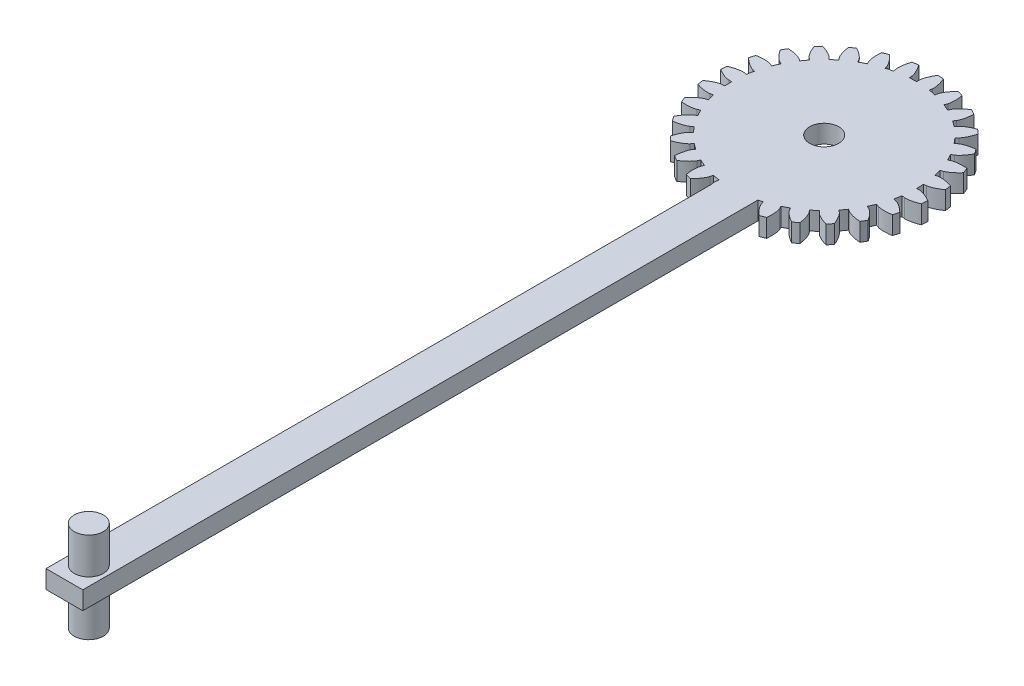
from build123d import *

# Parameters (mm, degrees)
EXTRUDE_1_DEPTH      = 5
EXTRUDE_2_DEPTH      = 5
SKETCH_4_W           = 10.147504873
SKETCH_4_H           = 5
EXTRUDE_3_DEPTH      = 180
SKETCH_5_R           = 4
CUT_EXTRUDE_1_DEPTH  = 5
EXTRUDE_4_DEPTH      = 10
EXTRUDE_4_DEPTH_BACK = 15
SKETCH_6_R           = 4


with BuildPart() as part:
    # 草图2 → 凸台-拉伸1 (new body)
    with BuildSketch(Plane(origin=(0, 0, 0), x_dir=(1, 0, 0), z_dir=(0, 1, 0))):
        with BuildLine():
            ThreePointArc((5.674283816, 24.860661761), (4.721957639, 25.058992718), (3.762759949, 25.220857193))
            Line((3.762759949, 25.220857193), (3.882488518, 26.023368433))
            add(Edge.make_bspline(
                [(3.882488518, 26.023368433), (3.885169692, 26.044536124), (3.891229626, 26.104071682), (3.896943735, 26.217198026), (3.89805291, 26.402160209), (3.882559672, 26.746092522), (3.8224221, 27.265903373), (3.710566644, 27.833686628), (3.551908723, 28.428019082), (3.361840182, 29.019737609), (3.221786448, 29.39905368), (3.111462526, 29.673387537), (3.03867645, 29.845710671)],
                knots=[0, 0, 0, 0, 0, 0.005376748, 0.015083688, 0.02853182, 0.046610139, 0.092110525, 0.146842495, 0.174208853, 0.201574955, 0.248725847, 0.248725847, 0.248725847, 0.248725847, 0.248725847], degree=4))
            ThreePointArc((3.03867645, 29.845710671), (2.219470551, 29.917786524), (1.398596861, 29.967381047))
            add(Edge.make_bspline(
                [(0, 26.311393382), (0.000471664, 26.332724987), (0.003263086, 26.392503021), (0.014304363, 26.505234166), (0.040500204, 26.688335279), (0.106574223, 27.026216471), (0.242756363, 27.531463216), (0.437169013, 28.076525771), (0.681789371, 28.640940763), (0.957090794, 29.198135514), (1.151582972, 29.552633078), (1.301179692, 29.807684553), (1.398596861, 29.967381047)],
                knots=[0, 0, 0, 0, 0, 0.005376748, 0.015083688, 0.02853182, 0.046610139, 0.092110525, 0.146842495, 0.174208853, 0.201574955, 0.248725847, 0.248725847, 0.248725847, 0.248725847, 0.248725847], degree=4))
            Line((0, 26.311393382), (0, 25.5))
            ThreePointArc((0, 25.5), (-0.972582162, 25.481445876), (-1.943748997, 25.425810505))
            Line((-1.943748997, 25.425810505), (-2.005597824, 26.234843226))
            add(Edge.make_bspline(
                [(-2.005597824, 26.234843226), (-2.007694127, 26.256076816), (-2.015034035, 26.315468155), (-2.034636171, 26.427029694), (-2.074712763, 26.607601304), (-2.166349692, 26.939462946), (-2.340648286, 27.432859185), (-2.576042953, 27.961516748), (-2.862974401, 28.505643338), (-3.179947286, 29.040232016), (-3.400895347, 29.378872954), (-3.569498244, 29.621779306), (-3.678804926, 29.773585513)],
                knots=[0, 0, 0, 0, 0, 0.005376748, 0.015083688, 0.02853182, 0.046610139, 0.092110525, 0.146842495, 0.174208853, 0.201574955, 0.248725847, 0.248725847, 0.248725847, 0.248725847, 0.248725847], degree=4))
            ThreePointArc((-3.678804926, 29.773585513), (-4.493510008, 29.661563812), (-5.304838501, 29.527253317))
            add(Edge.make_bspline(
                [(-5.854835829, 25.651711817), (-5.859122719, 25.672613549), (-5.869703148, 25.731513973), (-5.884023739, 25.843875627), (-5.899228513, 26.028215136), (-5.909996746, 26.372327794), (-5.889656954, 26.895210325), (-5.821406464, 27.469867909), (-5.7085134, 28.074564988), (-5.564101855, 28.679050034), (-5.45336913, 29.067938185), (-5.364277406, 29.349883388), (-5.304838501, 29.527253317)],
                knots=[0, 0, 0, 0, 0, 0.005376748, 0.015083688, 0.02853182, 0.046610139, 0.092110525, 0.146842495, 0.174208853, 0.201574955, 0.248725847, 0.248725847, 0.248725847, 0.248725847, 0.248725847], degree=4))
            Line((-5.854835829, 25.651711817), (-5.674283816, 24.860661761))
            ThreePointArc((-5.674283816, 24.860661761), (-6.618352631, 24.626152936), (-7.552790252, 24.355807509))
            Line((-7.552790252, 24.355807509), (-7.793115116, 25.130793432))
            add(Edge.make_bspline(
                [(-7.793115116, 25.130793432), (-7.799883778, 25.15102818), (-7.820255476, 25.207297171), (-7.864190923, 25.311699744), (-7.943443675, 25.478826166), (-8.106629238, 25.781976208), (-8.386348794, 26.224216888), (-8.733478999, 26.687239661), (-9.134296034, 27.153875607), (-9.562278919, 27.604527929), (-9.853042048, 27.885512862), (-10.071469467, 28.084811371), (-10.211815661, 28.208488455)],
                knots=[0, 0, 0, 0, 0, 0.005376748, 0.015083688, 0.02853182, 0.046610139, 0.092110525, 0.146842495, 0.174208853, 0.201574955, 0.248725847, 0.248725847, 0.248725847, 0.248725847, 0.248725847], degree=4))
            ThreePointArc((-10.211815661, 28.208488455), (-10.981167213, 27.917986436), (-11.74226711, 27.606505811))
            add(Edge.make_bspline(
                [(-11.416085742, 23.705746308), (-11.424916224, 23.725170068), (-11.448337956, 23.780239368), (-11.48730232, 23.88659725), (-11.543145279, 24.062931602), (-11.6302158, 24.39602048), (-11.726738278, 24.910319284), (-11.788072312, 25.485756165), (-11.812567472, 26.100413296), (-11.806287203, 26.721877232), (-11.784866534, 27.125655494), (-11.760747234, 27.420356516), (-11.74226711, 27.606505811)],
                knots=[0, 0, 0, 0, 0, 0.005376748, 0.015083688, 0.02853182, 0.046610139, 0.092110525, 0.146842495, 0.174208853, 0.201574955, 0.248725847, 0.248725847, 0.248725847, 0.248725847, 0.248725847], degree=4))
            Line((-11.416085742, 23.705746308), (-11.064035347, 22.974706132))
            ThreePointArc((-11.064035347, 22.974706132), (-11.932251264, 22.536001859), (-12.783103065, 22.064502623))
            Line((-12.783103065, 22.064502623), (-13.189853074, 22.766580718))
            add(Edge.make_bspline(
                [(-13.189853074, 22.766580718), (-13.200954688, 22.784801969), (-13.233336653, 22.83512705), (-13.299402305, 22.927135476), (-13.413857152, 23.072436294), (-13.640408543, 23.331673528), (-14.011522755, 23.700582853), (-14.452981941, 24.074752941), (-14.947585923, 24.440499168), (-15.465117958, 24.784617545), (-15.811116079, 24.993856716), (-16.068415157, 25.139553722), (-16.232763319, 25.228899996)],
                knots=[0, 0, 0, 0, 0, 0.005376748, 0.015083688, 0.02853182, 0.046610139, 0.092110525, 0.146842495, 0.174208853, 0.201574955, 0.248725847, 0.248725847, 0.248725847, 0.248725847, 0.248725847], degree=4))
            ThreePointArc((-16.232763319, 25.228899996), (-16.91818284, 24.774484644), (-17.590889414, 24.301452829))
            add(Edge.make_bspline(
                [(-16.404885446, 20.571075694), (-16.417816723, 20.588047492), (-16.452905295, 20.636524264), (-16.514559597, 20.731545145), (-16.60824054, 20.8910322), (-16.76724727, 21.19639483), (-16.975791979, 21.676320818), (-17.163634993, 22.223682188), (-17.324290086, 22.817477896), (-17.456456012, 23.424757924), (-17.52542152, 23.82317917), (-17.567484088, 24.115858471), (-17.590889414, 24.301452829)],
                knots=[0, 0, 0, 0, 0, 0.005376748, 0.015083688, 0.02853182, 0.046610139, 0.092110525, 0.146842495, 0.174208853, 0.201574955, 0.248725847, 0.248725847, 0.248725847, 0.248725847, 0.248725847], degree=4))
            Line((-16.404885446, 20.571075694), (-15.898989947, 19.936702803))
            ThreePointArc((-15.898989947, 19.936702803), (-16.647816994, 19.315801545), (-17.372417714, 18.666791443))
            Line((-17.372417714, 18.666791443), (-17.925196724, 19.260756582))
            add(Edge.make_bspline(
                [(-17.925196724, 19.260756582), (-17.940074607, 19.276050647), (-17.982843073, 19.317908308), (-18.067726121, 19.3929089), (-18.21164382, 19.509098123), (-18.490200806, 19.711423312), (-18.934100457, 19.988502629), (-19.447752018, 20.255057581), (-20.011341437, 20.501574047), (-20.592471407, 20.721902945), (-20.976354728, 20.848904229), (-21.259623414, 20.933693875), (-21.439732441, 20.984229146)],
                knots=[0, 0, 0, 0, 0, 0.005376748, 0.015083688, 0.02853182, 0.046610139, 0.092110525, 0.146842495, 0.174208853, 0.201574955, 0.248725847, 0.248725847, 0.248725847, 0.248725847, 0.248725847], degree=4))
            ThreePointArc((-21.439732441, 20.984229146), (-22.006850136, 20.388686743), (-22.55743107, 19.777823528))
            add(Edge.make_bspline(
                [(-20.571075694, 16.404885446), (-20.587459336, 16.418554246), (-20.632455262, 16.458007663), (-20.713707897, 16.536926799), (-20.840529271, 16.671569209), (-21.063498948, 16.933893435), (-21.373608584, 17.355381113), (-21.678541345, 17.847219988), (-21.967300456, 18.390378876), (-22.231285225, 18.953023441), (-22.387178691, 19.326109165), (-22.493313935, 19.602090583), (-22.55743107, 19.777823528)],
                knots=[0, 0, 0, 0, 0, 0.005376748, 0.015083688, 0.02853182, 0.046610139, 0.092110525, 0.146842495, 0.174208853, 0.201574955, 0.248725847, 0.248725847, 0.248725847, 0.248725847, 0.248725847], degree=4))
            Line((-20.571075694, 16.404885446), (-19.936702803, 15.898989947))
            ThreePointArc((-19.936702803, 15.898989947), (-20.528591664, 15.127026287), (-21.090606797, 14.333049394))
            Line((-21.090606797, 14.333049394), (-21.761696161, 14.789117685))
            add(Edge.make_bspline(
                [(-21.761696161, 14.789117685), (-21.779604274, 14.800717656), (-21.830614651, 14.832008979), (-21.930058706, 14.886240894), (-22.096222622, 14.96749231), (-22.412817192, 15.102760023), (-22.907243301, 15.274115418), (-23.467330601, 15.419689056), (-24.071644732, 15.534614396), (-24.687232352, 15.620105605), (-25.089751361, 15.658500626), (-25.384785381, 15.678131206), (-25.571623855, 15.687321423)],
                knots=[0, 0, 0, 0, 0, 0.005376748, 0.015083688, 0.02853182, 0.046610139, 0.092110525, 0.146842495, 0.174208853, 0.201574955, 0.248725847, 0.248725847, 0.248725847, 0.248725847, 0.248725847], degree=4))
            ThreePointArc((-25.571623855, 15.687321423), (-25.992002073, 14.980514953), (-26.39284894, 14.262451571))
            add(Edge.make_bspline(
                [(-23.705746308, 11.416085742), (-23.724760773, 11.425766133), (-23.777407768, 11.454217835), (-23.874184389, 11.513077892), (-24.027786842, 11.616124125), (-24.303538835, 11.822255913), (-24.699663207, 12.164170129), (-25.106395113, 12.575823654), (-25.508778653, 13.041109468), (-25.891344967, 13.530905222), (-26.126349242, 13.859947348), (-26.291235096, 14.105392022), (-26.39284894, 14.262451571)],
                knots=[0, 0, 0, 0, 0, 0.005376748, 0.015083688, 0.02853182, 0.046610139, 0.092110525, 0.146842495, 0.174208853, 0.201574955, 0.248725847, 0.248725847, 0.248725847, 0.248725847, 0.248725847], degree=4))
            Line((-23.705746308, 11.416085742), (-22.974706132, 11.064035347))
            ThreePointArc((-22.974706132, 11.064035347), (-23.379977028, 10.179718766), (-23.751224789, 9.280588399))
            Line((-23.751224789, 9.280588399), (-24.506973283, 9.575890673))
            add(Edge.make_bspline(
                [(-24.506973283, 9.575890673), (-24.527013639, 9.583214879), (-24.583708053, 9.602370786), (-24.692726575, 9.63311461), (-24.872804556, 9.675353934), (-25.211561337, 9.736781283), (-25.731721314, 9.793820281), (-26.310159238, 9.811112935), (-26.924895245, 9.788684312), (-27.544072382, 9.735050946), (-27.945043095, 9.682914418), (-28.237048212, 9.636401573), (-28.42124727, 9.6037859)],
                knots=[0, 0, 0, 0, 0, 0.005376748, 0.015083688, 0.02853182, 0.046610139, 0.092110525, 0.146842495, 0.174208853, 0.201574955, 0.248725847, 0.248725847, 0.248725847, 0.248725847, 0.248725847], degree=4))
            ThreePointArc((-28.42124727, 9.6037859), (-28.673806493, 8.82115759), (-28.904819158, 8.031900736))
            add(Edge.make_bspline(
                [(-25.651711817, 5.854835829), (-25.672403638, 5.860042396), (-25.730061763, 5.876065696), (-25.837509587, 5.911915184), (-26.01019085, 5.978198071), (-26.324897803, 6.117801115), (-26.78717358, 6.362996862), (-27.275309395, 6.67382301), (-27.771140173, 7.037904376), (-28.253104559, 7.430290914), (-28.555435548, 7.698789896), (-28.770803948, 7.901390206), (-28.904819158, 8.031900736)],
                knots=[0, 0, 0, 0, 0, 0.005376748, 0.015083688, 0.02853182, 0.046610139, 0.092110525, 0.146842495, 0.174208853, 0.201574955, 0.248725847, 0.248725847, 0.248725847, 0.248725847, 0.248725847], degree=4))
            Line((-25.651711817, 5.854835829), (-24.860661761, 5.674283816))
            ThreePointArc((-24.860661761, 5.674283816), (-25.058992718, 4.721957639), (-25.220857193, 3.762759949))
            Line((-25.220857193, 3.762759949), (-26.023368433, 3.882488518))
            add(Edge.make_bspline(
                [(-26.023368433, 3.882488518), (-26.044536124, 3.885169692), (-26.104071682, 3.891229626), (-26.217198026, 3.896943735), (-26.402160209, 3.89805291), (-26.746092522, 3.882559672), (-27.265903373, 3.8224221), (-27.833686628, 3.710566644), (-28.428019082, 3.551908723), (-29.019737609, 3.361840182), (-29.39905368, 3.221786448), (-29.673387537, 3.111462526), (-29.845710671, 3.03867645)],
                knots=[0, 0, 0, 0, 0, 0.005376748, 0.015083688, 0.02853182, 0.046610139, 0.092110525, 0.146842495, 0.174208853, 0.201574955, 0.248725847, 0.248725847, 0.248725847, 0.248725847, 0.248725847], degree=4))
            ThreePointArc((-29.845710671, 3.03867645), (-29.917786524, 2.219470551), (-29.967381047, 1.398596861))
            add(Edge.make_bspline(
                [(-26.311393382, 0), (-26.332724987, 0.000471664), (-26.392503021, 0.003263086), (-26.505234166, 0.014304363), (-26.688335279, 0.040500204), (-27.026216471, 0.106574223), (-27.531463216, 0.242756363), (-28.076525771, 0.437169013), (-28.640940763, 0.681789371), (-29.198135514, 0.957090794), (-29.552633078, 1.151582972), (-29.807684553, 1.301179692), (-29.967381047, 1.398596861)],
                knots=[0, 0, 0, 0, 0, 0.005376748, 0.015083688, 0.02853182, 0.046610139, 0.092110525, 0.146842495, 0.174208853, 0.201574955, 0.248725847, 0.248725847, 0.248725847, 0.248725847, 0.248725847], degree=4))
            Line((-26.311393382, 0), (-25.5, 0))
            ThreePointArc((-25.5, 0), (-25.481445876, -0.972582162), (-25.425810505, -1.943748997))
            Line((-25.425810505, -1.943748997), (-26.234843226, -2.005597824))
            add(Edge.make_bspline(
                [(-26.234843226, -2.005597824), (-26.256076816, -2.007694127), (-26.315468155, -2.015034035), (-26.427029694, -2.034636171), (-26.607601304, -2.074712763), (-26.939462946, -2.166349692), (-27.432859185, -2.340648286), (-27.961516748, -2.576042953), (-28.505643338, -2.862974401), (-29.040232016, -3.179947286), (-29.378872954, -3.400895347), (-29.621779306, -3.569498244), (-29.773585513, -3.678804926)],
                knots=[0, 0, 0, 0, 0, 0.005376748, 0.015083688, 0.02853182, 0.046610139, 0.092110525, 0.146842495, 0.174208853, 0.201574955, 0.248725847, 0.248725847, 0.248725847, 0.248725847, 0.248725847], degree=4))
            ThreePointArc((-29.773585513, -3.678804926), (-29.661563812, -4.493510008), (-29.527253317, -5.304838501))
            add(Edge.make_bspline(
                [(-25.651711817, -5.854835829), (-25.672613549, -5.859122719), (-25.731513973, -5.869703148), (-25.843875627, -5.884023739), (-26.028215136, -5.899228513), (-26.372327794, -5.909996746), (-26.895210325, -5.889656954), (-27.469867909, -5.821406464), (-28.074564988, -5.7085134), (-28.679050034, -5.564101855), (-29.067938185, -5.45336913), (-29.349883388, -5.364277406), (-29.527253317, -5.304838501)],
                knots=[0, 0, 0, 0, 0, 0.005376748, 0.015083688, 0.02853182, 0.046610139, 0.092110525, 0.146842495, 0.174208853, 0.201574955, 0.248725847, 0.248725847, 0.248725847, 0.248725847, 0.248725847], degree=4))
            Line((-25.651711817, -5.854835829), (-24.860661761, -5.674283816))
            ThreePointArc((-24.860661761, -5.674283816), (-24.626152936, -6.618352631), (-24.355807509, -7.552790252))
            Line((-24.355807509, -7.552790252), (-25.130793432, -7.793115116))
            add(Edge.make_bspline(
                [(-25.130793432, -7.793115116), (-25.15102818, -7.799883778), (-25.207297171, -7.820255476), (-25.311699744, -7.864190923), (-25.478826166, -7.943443675), (-25.781976208, -8.106629238), (-26.224216888, -8.386348794), (-26.687239661, -8.733478999), (-27.153875607, -9.134296034), (-27.604527929, -9.562278919), (-27.885512862, -9.853042048), (-28.084811371, -10.071469467), (-28.208488455, -10.211815661)],
                knots=[0, 0, 0, 0, 0, 0.005376748, 0.015083688, 0.02853182, 0.046610139, 0.092110525, 0.146842495, 0.174208853, 0.201574955, 0.248725847, 0.248725847, 0.248725847, 0.248725847, 0.248725847], degree=4))
            ThreePointArc((-28.208488455, -10.211815661), (-27.917986436, -10.981167213), (-27.606505811, -11.74226711))
            add(Edge.make_bspline(
                [(-23.705746308, -11.416085742), (-23.725170068, -11.424916224), (-23.780239368, -11.448337956), (-23.88659725, -11.48730232), (-24.062931602, -11.543145279), (-24.39602048, -11.6302158), (-24.910319284, -11.726738278), (-25.485756165, -11.788072312), (-26.100413296, -11.812567472), (-26.721877232, -11.806287203), (-27.125655494, -11.784866534), (-27.420356516, -11.760747234), (-27.606505811, -11.74226711)],
                knots=[0, 0, 0, 0, 0, 0.005376748, 0.015083688, 0.02853182, 0.046610139, 0.092110525, 0.146842495, 0.174208853, 0.201574955, 0.248725847, 0.248725847, 0.248725847, 0.248725847, 0.248725847], degree=4))
            Line((-23.705746308, -11.416085742), (-22.974706132, -11.064035347))
            ThreePointArc((-22.974706132, -11.064035347), (-22.536001859, -11.932251264), (-22.064502623, -12.783103065))
            Line((-22.064502623, -12.783103065), (-22.766580718, -13.189853074))
            add(Edge.make_bspline(
                [(-22.766580718, -13.189853074), (-22.784801969, -13.200954688), (-22.83512705, -13.233336653), (-22.927135476, -13.299402305), (-23.072436294, -13.413857152), (-23.331673528, -13.640408543), (-23.700582853, -14.011522755), (-24.074752941, -14.452981941), (-24.440499168, -14.947585923), (-24.784617545, -15.465117958), (-24.993856716, -15.811116079), (-25.139553722, -16.068415157), (-25.228899996, -16.232763319)],
                knots=[0, 0, 0, 0, 0, 0.005376748, 0.015083688, 0.02853182, 0.046610139, 0.092110525, 0.146842495, 0.174208853, 0.201574955, 0.248725847, 0.248725847, 0.248725847, 0.248725847, 0.248725847], degree=4))
            ThreePointArc((-25.228899996, -16.232763319), (-24.774484644, -16.91818284), (-24.301452829, -17.590889414))
            add(Edge.make_bspline(
                [(-20.571075694, -16.404885446), (-20.588047492, -16.417816723), (-20.636524264, -16.452905295), (-20.731545145, -16.514559597), (-20.8910322, -16.60824054), (-21.19639483, -16.76724727), (-21.676320818, -16.975791979), (-22.223682188, -17.163634993), (-22.817477896, -17.324290086), (-23.424757924, -17.456456012), (-23.82317917, -17.52542152), (-24.115858471, -17.567484088), (-24.301452829, -17.590889414)],
                knots=[0, 0, 0, 0, 0, 0.005376748, 0.015083688, 0.02853182, 0.046610139, 0.092110525, 0.146842495, 0.174208853, 0.201574955, 0.248725847, 0.248725847, 0.248725847, 0.248725847, 0.248725847], degree=4))
            Line((-20.571075694, -16.404885446), (-19.936702803, -15.898989947))
            ThreePointArc((-19.936702803, -15.898989947), (-19.315801545, -16.647816994), (-18.666791443, -17.372417714))
            Line((-18.666791443, -17.372417714), (-19.260756582, -17.925196724))
            add(Edge.make_bspline(
                [(-19.260756582, -17.925196724), (-19.276050647, -17.940074607), (-19.317908308, -17.982843073), (-19.3929089, -18.067726121), (-19.509098123, -18.21164382), (-19.711423312, -18.490200806), (-19.988502629, -18.934100457), (-20.255057581, -19.447752018), (-20.501574047, -20.011341437), (-20.721902945, -20.592471407), (-20.848904229, -20.976354728), (-20.933693875, -21.259623414), (-20.984229146, -21.439732441)],
                knots=[0, 0, 0, 0, 0, 0.005376748, 0.015083688, 0.02853182, 0.046610139, 0.092110525, 0.146842495, 0.174208853, 0.201574955, 0.248725847, 0.248725847, 0.248725847, 0.248725847, 0.248725847], degree=4))
            ThreePointArc((-20.984229146, -21.439732441), (-20.388686743, -22.006850136), (-19.777823528, -22.55743107))
            add(Edge.make_bspline(
                [(-16.404885446, -20.571075694), (-16.418554246, -20.587459336), (-16.458007663, -20.632455262), (-16.536926799, -20.713707897), (-16.671569209, -20.840529271), (-16.933893435, -21.063498948), (-17.355381113, -21.373608584), (-17.847219988, -21.678541345), (-18.390378876, -21.967300456), (-18.953023441, -22.231285225), (-19.326109165, -22.387178691), (-19.602090583, -22.493313935), (-19.777823528, -22.55743107)],
                knots=[0, 0, 0, 0, 0, 0.005376748, 0.015083688, 0.02853182, 0.046610139, 0.092110525, 0.146842495, 0.174208853, 0.201574955, 0.248725847, 0.248725847, 0.248725847, 0.248725847, 0.248725847], degree=4))
            Line((-16.404885446, -20.571075694), (-15.898989947, -19.936702803))
            ThreePointArc((-15.898989947, -19.936702803), (-15.127026287, -20.528591664), (-14.333049394, -21.090606797))
            Line((-14.333049394, -21.090606797), (-14.789117685, -21.761696161))
            add(Edge.make_bspline(
                [(-14.789117685, -21.761696161), (-14.800717656, -21.779604274), (-14.832008979, -21.830614651), (-14.886240894, -21.930058706), (-14.96749231, -22.096222622), (-15.102760023, -22.412817192), (-15.274115418, -22.907243301), (-15.419689056, -23.467330601), (-15.534614396, -24.071644732), (-15.620105605, -24.687232352), (-15.658500626, -25.089751361), (-15.678131206, -25.384785381), (-15.687321423, -25.571623855)],
                knots=[0, 0, 0, 0, 0, 0.005376748, 0.015083688, 0.02853182, 0.046610139, 0.092110525, 0.146842495, 0.174208853, 0.201574955, 0.248725847, 0.248725847, 0.248725847, 0.248725847, 0.248725847], degree=4))
            ThreePointArc((-15.687321423, -25.571623855), (-14.980514953, -25.992002073), (-14.262451571, -26.39284894))
            add(Edge.make_bspline(
                [(-11.416085742, -23.705746308), (-11.425766133, -23.724760773), (-11.454217835, -23.777407768), (-11.513077892, -23.874184389), (-11.616124125, -24.027786842), (-11.822255913, -24.303538835), (-12.164170129, -24.699663207), (-12.575823654, -25.106395113), (-13.041109468, -25.508778653), (-13.530905222, -25.891344967), (-13.859947348, -26.126349242), (-14.105392022, -26.291235096), (-14.262451571, -26.39284894)],
                knots=[0, 0, 0, 0, 0, 0.005376748, 0.015083688, 0.02853182, 0.046610139, 0.092110525, 0.146842495, 0.174208853, 0.201574955, 0.248725847, 0.248725847, 0.248725847, 0.248725847, 0.248725847], degree=4))
            Line((-11.416085742, -23.705746308), (-11.064035347, -22.974706132))
            ThreePointArc((-11.064035347, -22.974706132), (-10.179718766, -23.379977028), (-9.280588399, -23.751224789))
            Line((-9.280588399, -23.751224789), (-9.575890673, -24.506973283))
            add(Edge.make_bspline(
                [(-9.575890673, -24.506973283), (-9.583214879, -24.527013639), (-9.602370786, -24.583708053), (-9.63311461, -24.692726575), (-9.675353934, -24.872804556), (-9.736781283, -25.211561337), (-9.793820281, -25.731721314), (-9.811112935, -26.310159238), (-9.788684312, -26.924895245), (-9.735050946, -27.544072382), (-9.682914418, -27.945043095), (-9.636401573, -28.237048212), (-9.6037859, -28.42124727)],
                knots=[0, 0, 0, 0, 0, 0.005376748, 0.015083688, 0.02853182, 0.046610139, 0.092110525, 0.146842495, 0.174208853, 0.201574955, 0.248725847, 0.248725847, 0.248725847, 0.248725847, 0.248725847], degree=4))
            ThreePointArc((-9.6037859, -28.42124727), (-8.82115759, -28.673806493), (-8.031900736, -28.904819158))
            add(Edge.make_bspline(
                [(-5.854835829, -25.651711817), (-5.860042396, -25.672403638), (-5.876065696, -25.730061763), (-5.911915184, -25.837509587), (-5.978198071, -26.01019085), (-6.117801115, -26.324897803), (-6.362996862, -26.78717358), (-6.67382301, -27.275309395), (-7.037904376, -27.771140173), (-7.430290914, -28.253104559), (-7.698789896, -28.555435548), (-7.901390206, -28.770803948), (-8.031900736, -28.904819158)],
                knots=[0, 0, 0, 0, 0, 0.005376748, 0.015083688, 0.02853182, 0.046610139, 0.092110525, 0.146842495, 0.174208853, 0.201574955, 0.248725847, 0.248725847, 0.248725847, 0.248725847, 0.248725847], degree=4))
            Line((-5.854835829, -25.651711817), (-5.674283816, -24.860661761))
            ThreePointArc((-5.674283816, -24.860661761), (-4.721957639, -25.058992718), (-3.762759949, -25.220857193))
            Line((-3.762759949, -25.220857193), (-3.882488518, -26.023368433))
            add(Edge.make_bspline(
                [(-3.882488518, -26.023368433), (-3.885169692, -26.044536124), (-3.891229626, -26.104071682), (-3.896943735, -26.217198026), (-3.89805291, -26.402160209), (-3.882559672, -26.746092522), (-3.8224221, -27.265903373), (-3.710566644, -27.833686628), (-3.551908723, -28.428019082), (-3.361840182, -29.019737609), (-3.221786448, -29.39905368), (-3.111462526, -29.673387537), (-3.03867645, -29.845710671)],
                knots=[0, 0, 0, 0, 0, 0.005376748, 0.015083688, 0.02853182, 0.046610139, 0.092110525, 0.146842495, 0.174208853, 0.201574955, 0.248725847, 0.248725847, 0.248725847, 0.248725847, 0.248725847], degree=4))
            ThreePointArc((-3.03867645, -29.845710671), (-2.219470551, -29.917786524), (-1.398596861, -29.967381047))
            add(Edge.make_bspline(
                [(0, -26.311393382), (-0.000471664, -26.332724987), (-0.003263086, -26.392503021), (-0.014304363, -26.505234166), (-0.040500204, -26.688335279), (-0.106574223, -27.026216471), (-0.242756363, -27.531463216), (-0.437169013, -28.076525771), (-0.681789371, -28.640940763), (-0.957090794, -29.198135514), (-1.151582972, -29.552633078), (-1.301179692, -29.807684553), (-1.398596861, -29.967381047)],
                knots=[0, 0, 0, 0, 0, 0.005376748, 0.015083688, 0.02853182, 0.046610139, 0.092110525, 0.146842495, 0.174208853, 0.201574955, 0.248725847, 0.248725847, 0.248725847, 0.248725847, 0.248725847], degree=4))
            Line((0, -26.311393382), (0, -25.5))
            ThreePointArc((0, -25.5), (0.972582162, -25.481445876), (1.943748997, -25.425810505))
            Line((1.943748997, -25.425810505), (2.005597824, -26.234843226))
            add(Edge.make_bspline(
                [(2.005597824, -26.234843226), (2.007694127, -26.256076816), (2.015034035, -26.315468155), (2.034636171, -26.427029694), (2.074712763, -26.607601304), (2.166349692, -26.939462946), (2.340648286, -27.432859185), (2.576042953, -27.961516748), (2.862974401, -28.505643338), (3.179947286, -29.040232016), (3.400895347, -29.378872954), (3.569498244, -29.621779306), (3.678804926, -29.773585513)],
                knots=[0, 0, 0, 0, 0, 0.005376748, 0.015083688, 0.02853182, 0.046610139, 0.092110525, 0.146842495, 0.174208853, 0.201574955, 0.248725847, 0.248725847, 0.248725847, 0.248725847, 0.248725847], degree=4))
            ThreePointArc((3.678804926, -29.773585513), (4.493510008, -29.661563812), (5.304838501, -29.527253317))
            add(Edge.make_bspline(
                [(5.854835829, -25.651711817), (5.859122719, -25.672613549), (5.869703148, -25.731513973), (5.884023739, -25.843875627), (5.899228513, -26.028215136), (5.909996746, -26.372327794), (5.889656954, -26.895210325), (5.821406464, -27.469867909), (5.7085134, -28.074564988), (5.564101855, -28.679050034), (5.45336913, -29.067938185), (5.364277406, -29.349883388), (5.304838501, -29.527253317)],
                knots=[0, 0, 0, 0, 0, 0.005376748, 0.015083688, 0.02853182, 0.046610139, 0.092110525, 0.146842495, 0.174208853, 0.201574955, 0.248725847, 0.248725847, 0.248725847, 0.248725847, 0.248725847], degree=4))
            Line((5.854835829, -25.651711817), (5.674283816, -24.860661761))
            ThreePointArc((5.674283816, -24.860661761), (6.618352631, -24.626152936), (7.552790252, -24.355807509))
            Line((7.552790252, -24.355807509), (7.793115116, -25.130793432))
            add(Edge.make_bspline(
                [(7.793115116, -25.130793432), (7.799883778, -25.15102818), (7.820255476, -25.207297171), (7.864190923, -25.311699744), (7.943443675, -25.478826166), (8.106629238, -25.781976208), (8.386348794, -26.224216888), (8.733478999, -26.687239661), (9.134296034, -27.153875607), (9.562278919, -27.604527929), (9.853042048, -27.885512862), (10.071469467, -28.084811371), (10.211815661, -28.208488455)],
                knots=[0, 0, 0, 0, 0, 0.005376748, 0.015083688, 0.02853182, 0.046610139, 0.092110525, 0.146842495, 0.174208853, 0.201574955, 0.248725847, 0.248725847, 0.248725847, 0.248725847, 0.248725847], degree=4))
            ThreePointArc((10.211815661, -28.208488455), (10.981167213, -27.917986436), (11.74226711, -27.606505811))
            add(Edge.make_bspline(
                [(11.416085742, -23.705746308), (11.424916224, -23.725170068), (11.448337956, -23.780239368), (11.48730232, -23.88659725), (11.543145279, -24.062931602), (11.6302158, -24.39602048), (11.726738278, -24.910319284), (11.788072312, -25.485756165), (11.812567472, -26.100413296), (11.806287203, -26.721877232), (11.784866534, -27.125655494), (11.760747234, -27.420356516), (11.74226711, -27.606505811)],
                knots=[0, 0, 0, 0, 0, 0.005376748, 0.015083688, 0.02853182, 0.046610139, 0.092110525, 0.146842495, 0.174208853, 0.201574955, 0.248725847, 0.248725847, 0.248725847, 0.248725847, 0.248725847], degree=4))
            Line((11.416085742, -23.705746308), (11.064035347, -22.974706132))
            ThreePointArc((11.064035347, -22.974706132), (11.932251264, -22.536001859), (12.783103065, -22.064502623))
            Line((12.783103065, -22.064502623), (13.189853074, -22.766580718))
            add(Edge.make_bspline(
                [(13.189853074, -22.766580718), (13.200954688, -22.784801969), (13.233336653, -22.83512705), (13.299402305, -22.927135476), (13.413857152, -23.072436294), (13.640408543, -23.331673528), (14.011522755, -23.700582853), (14.452981941, -24.074752941), (14.947585923, -24.440499168), (15.465117958, -24.784617545), (15.811116079, -24.993856716), (16.068415157, -25.139553722), (16.232763319, -25.228899996)],
                knots=[0, 0, 0, 0, 0, 0.005376748, 0.015083688, 0.02853182, 0.046610139, 0.092110525, 0.146842495, 0.174208853, 0.201574955, 0.248725847, 0.248725847, 0.248725847, 0.248725847, 0.248725847], degree=4))
            ThreePointArc((16.232763319, -25.228899996), (16.91818284, -24.774484644), (17.590889414, -24.301452829))
            add(Edge.make_bspline(
                [(16.404885446, -20.571075694), (16.417816723, -20.588047492), (16.452905295, -20.636524264), (16.514559597, -20.731545145), (16.60824054, -20.8910322), (16.76724727, -21.19639483), (16.975791979, -21.676320818), (17.163634993, -22.223682188), (17.324290086, -22.817477896), (17.456456012, -23.424757924), (17.52542152, -23.82317917), (17.567484088, -24.115858471), (17.590889414, -24.301452829)],
                knots=[0, 0, 0, 0, 0, 0.005376748, 0.015083688, 0.02853182, 0.046610139, 0.092110525, 0.146842495, 0.174208853, 0.201574955, 0.248725847, 0.248725847, 0.248725847, 0.248725847, 0.248725847], degree=4))
            Line((16.404885446, -20.571075694), (15.898989947, -19.936702803))
            ThreePointArc((15.898989947, -19.936702803), (16.647816994, -19.315801545), (17.372417714, -18.666791443))
            Line((17.372417714, -18.666791443), (17.925196724, -19.260756582))
            add(Edge.make_bspline(
                [(17.925196724, -19.260756582), (17.940074607, -19.276050647), (17.982843073, -19.317908308), (18.067726121, -19.3929089), (18.21164382, -19.509098123), (18.490200806, -19.711423312), (18.934100457, -19.988502629), (19.447752018, -20.255057581), (20.011341437, -20.501574047), (20.592471407, -20.721902945), (20.976354728, -20.848904229), (21.259623414, -20.933693875), (21.439732441, -20.984229146)],
                knots=[0, 0, 0, 0, 0, 0.005376748, 0.015083688, 0.02853182, 0.046610139, 0.092110525, 0.146842495, 0.174208853, 0.201574955, 0.248725847, 0.248725847, 0.248725847, 0.248725847, 0.248725847], degree=4))
            ThreePointArc((21.439732441, -20.984229146), (22.006850136, -20.388686743), (22.55743107, -19.777823528))
            add(Edge.make_bspline(
                [(20.571075694, -16.404885446), (20.587459336, -16.418554246), (20.632455262, -16.458007663), (20.713707897, -16.536926799), (20.840529271, -16.671569209), (21.063498948, -16.933893435), (21.373608584, -17.355381113), (21.678541345, -17.847219988), (21.967300456, -18.390378876), (22.231285225, -18.953023441), (22.387178691, -19.326109165), (22.493313935, -19.602090583), (22.55743107, -19.777823528)],
                knots=[0, 0, 0, 0, 0, 0.005376748, 0.015083688, 0.02853182, 0.046610139, 0.092110525, 0.146842495, 0.174208853, 0.201574955, 0.248725847, 0.248725847, 0.248725847, 0.248725847, 0.248725847], degree=4))
            Line((20.571075694, -16.404885446), (19.936702803, -15.898989947))
            ThreePointArc((19.936702803, -15.898989947), (20.528591664, -15.127026287), (21.090606797, -14.333049394))
            Line((21.090606797, -14.333049394), (21.761696161, -14.789117685))
            add(Edge.make_bspline(
                [(21.761696161, -14.789117685), (21.779604274, -14.800717656), (21.830614651, -14.832008979), (21.930058706, -14.886240894), (22.096222622, -14.96749231), (22.412817192, -15.102760023), (22.907243301, -15.274115418), (23.467330601, -15.419689056), (24.071644732, -15.534614396), (24.687232352, -15.620105605), (25.089751361, -15.658500626), (25.384785381, -15.678131206), (25.571623855, -15.687321423)],
                knots=[0, 0, 0, 0, 0, 0.005376748, 0.015083688, 0.02853182, 0.046610139, 0.092110525, 0.146842495, 0.174208853, 0.201574955, 0.248725847, 0.248725847, 0.248725847, 0.248725847, 0.248725847], degree=4))
            ThreePointArc((25.571623855, -15.687321423), (25.992002073, -14.980514953), (26.39284894, -14.262451571))
            add(Edge.make_bspline(
                [(23.705746308, -11.416085742), (23.724760773, -11.425766133), (23.777407768, -11.454217835), (23.874184389, -11.513077892), (24.027786842, -11.616124125), (24.303538835, -11.822255913), (24.699663207, -12.164170129), (25.106395113, -12.575823654), (25.508778653, -13.041109468), (25.891344967, -13.530905222), (26.126349242, -13.859947348), (26.291235096, -14.105392022), (26.39284894, -14.262451571)],
                knots=[0, 0, 0, 0, 0, 0.005376748, 0.015083688, 0.02853182, 0.046610139, 0.092110525, 0.146842495, 0.174208853, 0.201574955, 0.248725847, 0.248725847, 0.248725847, 0.248725847, 0.248725847], degree=4))
            Line((23.705746308, -11.416085742), (22.974706132, -11.064035347))
            ThreePointArc((22.974706132, -11.064035347), (23.379977028, -10.179718766), (23.751224789, -9.280588399))
            Line((23.751224789, -9.280588399), (24.506973283, -9.575890673))
            add(Edge.make_bspline(
                [(24.506973283, -9.575890673), (24.527013639, -9.583214879), (24.583708053, -9.602370786), (24.692726575, -9.63311461), (24.872804556, -9.675353934), (25.211561337, -9.736781283), (25.731721314, -9.793820281), (26.310159238, -9.811112935), (26.924895245, -9.788684312), (27.544072382, -9.735050946), (27.945043095, -9.682914418), (28.237048212, -9.636401573), (28.42124727, -9.6037859)],
                knots=[0, 0, 0, 0, 0, 0.005376748, 0.015083688, 0.02853182, 0.046610139, 0.092110525, 0.146842495, 0.174208853, 0.201574955, 0.248725847, 0.248725847, 0.248725847, 0.248725847, 0.248725847], degree=4))
            ThreePointArc((28.42124727, -9.6037859), (28.673806493, -8.82115759), (28.904819158, -8.031900736))
            add(Edge.make_bspline(
                [(25.651711817, -5.854835829), (25.672403638, -5.860042396), (25.730061763, -5.876065696), (25.837509587, -5.911915184), (26.01019085, -5.978198071), (26.324897803, -6.117801115), (26.78717358, -6.362996862), (27.275309395, -6.67382301), (27.771140173, -7.037904376), (28.253104559, -7.430290914), (28.555435548, -7.698789896), (28.770803948, -7.901390206), (28.904819158, -8.031900736)],
                knots=[0, 0, 0, 0, 0, 0.005376748, 0.015083688, 0.02853182, 0.046610139, 0.092110525, 0.146842495, 0.174208853, 0.201574955, 0.248725847, 0.248725847, 0.248725847, 0.248725847, 0.248725847], degree=4))
            Line((25.651711817, -5.854835829), (24.860661761, -5.674283816))
            ThreePointArc((24.860661761, -5.674283816), (25.058992718, -4.721957639), (25.220857193, -3.762759949))
            Line((25.220857193, -3.762759949), (26.023368433, -3.882488518))
            add(Edge.make_bspline(
                [(26.023368433, -3.882488518), (26.044536124, -3.885169692), (26.104071682, -3.891229626), (26.217198026, -3.896943735), (26.402160209, -3.89805291), (26.746092522, -3.882559672), (27.265903373, -3.8224221), (27.833686628, -3.710566644), (28.428019082, -3.551908723), (29.019737609, -3.361840182), (29.39905368, -3.221786448), (29.673387537, -3.111462526), (29.845710671, -3.03867645)],
                knots=[0, 0, 0, 0, 0, 0.005376748, 0.015083688, 0.02853182, 0.046610139, 0.092110525, 0.146842495, 0.174208853, 0.201574955, 0.248725847, 0.248725847, 0.248725847, 0.248725847, 0.248725847], degree=4))
            ThreePointArc((29.845710671, -3.03867645), (29.917786524, -2.219470551), (29.967381047, -1.398596861))
            add(Edge.make_bspline(
                [(26.311393382, 0), (26.332724987, -0.000471664), (26.392503021, -0.003263086), (26.505234166, -0.014304363), (26.688335279, -0.040500204), (27.026216471, -0.106574223), (27.531463216, -0.242756363), (28.076525771, -0.437169013), (28.640940763, -0.681789371), (29.198135514, -0.957090794), (29.552633078, -1.151582972), (29.807684553, -1.301179692), (29.967381047, -1.398596861)],
                knots=[0, 0, 0, 0, 0, 0.005376748, 0.015083688, 0.02853182, 0.046610139, 0.092110525, 0.146842495, 0.174208853, 0.201574955, 0.248725847, 0.248725847, 0.248725847, 0.248725847, 0.248725847], degree=4))
            Line((26.311393382, 0), (25.5, 0))
            ThreePointArc((25.5, 0), (25.481445876, 0.972582162), (25.425810505, 1.943748997))
            Line((25.425810505, 1.943748997), (26.234843226, 2.005597824))
            add(Edge.make_bspline(
                [(26.234843226, 2.005597824), (26.256076816, 2.007694127), (26.315468155, 2.015034035), (26.427029694, 2.034636171), (26.607601304, 2.074712763), (26.939462946, 2.166349692), (27.432859185, 2.340648286), (27.961516748, 2.576042953), (28.505643338, 2.862974401), (29.040232016, 3.179947286), (29.378872954, 3.400895347), (29.621779306, 3.569498244), (29.773585513, 3.678804926)],
                knots=[0, 0, 0, 0, 0, 0.005376748, 0.015083688, 0.02853182, 0.046610139, 0.092110525, 0.146842495, 0.174208853, 0.201574955, 0.248725847, 0.248725847, 0.248725847, 0.248725847, 0.248725847], degree=4))
            ThreePointArc((29.773585513, 3.678804926), (29.661563812, 4.493510008), (29.527253317, 5.304838501))
            add(Edge.make_bspline(
                [(25.651711817, 5.854835829), (25.672613549, 5.859122719), (25.731513973, 5.869703148), (25.843875627, 5.884023739), (26.028215136, 5.899228513), (26.372327794, 5.909996746), (26.895210325, 5.889656954), (27.469867909, 5.821406464), (28.074564988, 5.7085134), (28.679050034, 5.564101855), (29.067938185, 5.45336913), (29.349883388, 5.364277406), (29.527253317, 5.304838501)],
                knots=[0, 0, 0, 0, 0, 0.005376748, 0.015083688, 0.02853182, 0.046610139, 0.092110525, 0.146842495, 0.174208853, 0.201574955, 0.248725847, 0.248725847, 0.248725847, 0.248725847, 0.248725847], degree=4))
            Line((25.651711817, 5.854835829), (24.860661761, 5.674283816))
            ThreePointArc((24.860661761, 5.674283816), (24.626152936, 6.618352631), (24.355807509, 7.552790252))
            Line((24.355807509, 7.552790252), (25.130793432, 7.793115116))
            add(Edge.make_bspline(
                [(25.130793432, 7.793115116), (25.15102818, 7.799883778), (25.207297171, 7.820255476), (25.311699744, 7.864190923), (25.478826166, 7.943443675), (25.781976208, 8.106629238), (26.224216888, 8.386348794), (26.687239661, 8.733478999), (27.153875607, 9.134296034), (27.604527929, 9.562278919), (27.885512862, 9.853042048), (28.084811371, 10.071469467), (28.208488455, 10.211815661)],
                knots=[0, 0, 0, 0, 0, 0.005376748, 0.015083688, 0.02853182, 0.046610139, 0.092110525, 0.146842495, 0.174208853, 0.201574955, 0.248725847, 0.248725847, 0.248725847, 0.248725847, 0.248725847], degree=4))
            ThreePointArc((28.208488455, 10.211815661), (27.917986436, 10.981167213), (27.606505811, 11.74226711))
            add(Edge.make_bspline(
                [(23.705746308, 11.416085742), (23.725170068, 11.424916224), (23.780239368, 11.448337956), (23.88659725, 11.48730232), (24.062931602, 11.543145279), (24.39602048, 11.6302158), (24.910319284, 11.726738278), (25.485756165, 11.788072312), (26.100413296, 11.812567472), (26.721877232, 11.806287203), (27.125655494, 11.784866534), (27.420356516, 11.760747234), (27.606505811, 11.74226711)],
                knots=[0, 0, 0, 0, 0, 0.005376748, 0.015083688, 0.02853182, 0.046610139, 0.092110525, 0.146842495, 0.174208853, 0.201574955, 0.248725847, 0.248725847, 0.248725847, 0.248725847, 0.248725847], degree=4))
            Line((23.705746308, 11.416085742), (22.974706132, 11.064035347))
            ThreePointArc((22.974706132, 11.064035347), (22.536001859, 11.932251264), (22.064502623, 12.783103065))
            Line((22.064502623, 12.783103065), (22.766580718, 13.189853074))
            add(Edge.make_bspline(
                [(22.766580718, 13.189853074), (22.784801969, 13.200954688), (22.83512705, 13.233336653), (22.927135476, 13.299402305), (23.072436294, 13.413857152), (23.331673528, 13.640408543), (23.700582853, 14.011522755), (24.074752941, 14.452981941), (24.440499168, 14.947585923), (24.784617545, 15.465117958), (24.993856716, 15.811116079), (25.139553722, 16.068415157), (25.228899996, 16.232763319)],
                knots=[0, 0, 0, 0, 0, 0.005376748, 0.015083688, 0.02853182, 0.046610139, 0.092110525, 0.146842495, 0.174208853, 0.201574955, 0.248725847, 0.248725847, 0.248725847, 0.248725847, 0.248725847], degree=4))
            ThreePointArc((25.228899996, 16.232763319), (24.774484644, 16.91818284), (24.301452829, 17.590889414))
            add(Edge.make_bspline(
                [(20.571075694, 16.404885446), (20.588047492, 16.417816723), (20.636524264, 16.452905295), (20.731545145, 16.514559597), (20.8910322, 16.60824054), (21.19639483, 16.76724727), (21.676320818, 16.975791979), (22.223682188, 17.163634993), (22.817477896, 17.324290086), (23.424757924, 17.456456012), (23.82317917, 17.52542152), (24.115858471, 17.567484088), (24.301452829, 17.590889414)],
                knots=[0, 0, 0, 0, 0, 0.005376748, 0.015083688, 0.02853182, 0.046610139, 0.092110525, 0.146842495, 0.174208853, 0.201574955, 0.248725847, 0.248725847, 0.248725847, 0.248725847, 0.248725847], degree=4))
            Line((20.571075694, 16.404885446), (19.936702803, 15.898989947))
            ThreePointArc((19.936702803, 15.898989947), (19.315801545, 16.647816994), (18.666791443, 17.372417714))
            Line((18.666791443, 17.372417714), (19.260756582, 17.925196724))
            add(Edge.make_bspline(
                [(19.260756582, 17.925196724), (19.276050647, 17.940074607), (19.317908308, 17.982843073), (19.3929089, 18.067726121), (19.509098123, 18.21164382), (19.711423312, 18.490200806), (19.988502629, 18.934100457), (20.255057581, 19.447752018), (20.501574047, 20.011341437), (20.721902945, 20.592471407), (20.848904229, 20.976354728), (20.933693875, 21.259623414), (20.984229146, 21.439732441)],
                knots=[0, 0, 0, 0, 0, 0.005376748, 0.015083688, 0.02853182, 0.046610139, 0.092110525, 0.146842495, 0.174208853, 0.201574955, 0.248725847, 0.248725847, 0.248725847, 0.248725847, 0.248725847], degree=4))
            ThreePointArc((20.984229146, 21.439732441), (20.388686743, 22.006850136), (19.777823528, 22.55743107))
            add(Edge.make_bspline(
                [(16.404885446, 20.571075694), (16.418554246, 20.587459336), (16.458007663, 20.632455262), (16.536926799, 20.713707897), (16.671569209, 20.840529271), (16.933893435, 21.063498948), (17.355381113, 21.373608584), (17.847219988, 21.678541345), (18.390378876, 21.967300456), (18.953023441, 22.231285225), (19.326109165, 22.387178691), (19.602090583, 22.493313935), (19.777823528, 22.55743107)],
                knots=[0, 0, 0, 0, 0, 0.005376748, 0.015083688, 0.02853182, 0.046610139, 0.092110525, 0.146842495, 0.174208853, 0.201574955, 0.248725847, 0.248725847, 0.248725847, 0.248725847, 0.248725847], degree=4))
            Line((16.404885446, 20.571075694), (15.898989947, 19.936702803))
            ThreePointArc((15.898989947, 19.936702803), (15.127026287, 20.528591664), (14.333049394, 21.090606797))
            Line((14.333049394, 21.090606797), (14.789117685, 21.761696161))
            add(Edge.make_bspline(
                [(14.789117685, 21.761696161), (14.800717656, 21.779604274), (14.832008979, 21.830614651), (14.886240894, 21.930058706), (14.96749231, 22.096222622), (15.102760023, 22.412817192), (15.274115418, 22.907243301), (15.419689056, 23.467330601), (15.534614396, 24.071644732), (15.620105605, 24.687232352), (15.658500626, 25.089751361), (15.678131206, 25.384785381), (15.687321423, 25.571623855)],
                knots=[0, 0, 0, 0, 0, 0.005376748, 0.015083688, 0.02853182, 0.046610139, 0.092110525, 0.146842495, 0.174208853, 0.201574955, 0.248725847, 0.248725847, 0.248725847, 0.248725847, 0.248725847], degree=4))
            ThreePointArc((15.687321423, 25.571623855), (14.980514953, 25.992002073), (14.262451571, 26.39284894))
            add(Edge.make_bspline(
                [(11.416085742, 23.705746308), (11.425766133, 23.724760773), (11.454217835, 23.777407768), (11.513077892, 23.874184389), (11.616124125, 24.027786842), (11.822255913, 24.303538835), (12.164170129, 24.699663207), (12.575823654, 25.106395113), (13.041109468, 25.508778653), (13.530905222, 25.891344967), (13.859947348, 26.126349242), (14.105392022, 26.291235096), (14.262451571, 26.39284894)],
                knots=[0, 0, 0, 0, 0, 0.005376748, 0.015083688, 0.02853182, 0.046610139, 0.092110525, 0.146842495, 0.174208853, 0.201574955, 0.248725847, 0.248725847, 0.248725847, 0.248725847, 0.248725847], degree=4))
            Line((11.416085742, 23.705746308), (11.064035347, 22.974706132))
            ThreePointArc((11.064035347, 22.974706132), (10.179718766, 23.379977028), (9.280588399, 23.751224789))
            Line((9.280588399, 23.751224789), (9.575890673, 24.506973283))
            add(Edge.make_bspline(
                [(9.575890673, 24.506973283), (9.583214879, 24.527013639), (9.602370786, 24.583708053), (9.63311461, 24.692726575), (9.675353934, 24.872804556), (9.736781283, 25.211561337), (9.793820281, 25.731721314), (9.811112935, 26.310159238), (9.788684312, 26.924895245), (9.735050946, 27.544072382), (9.682914418, 27.945043095), (9.636401573, 28.237048212), (9.6037859, 28.42124727)],
                knots=[0, 0, 0, 0, 0, 0.005376748, 0.015083688, 0.02853182, 0.046610139, 0.092110525, 0.146842495, 0.174208853, 0.201574955, 0.248725847, 0.248725847, 0.248725847, 0.248725847, 0.248725847], degree=4))
            ThreePointArc((9.6037859, 28.42124727), (8.82115759, 28.673806493), (8.031900736, 28.904819158))
            add(Edge.make_bspline(
                [(5.854835829, 25.651711817), (5.860042396, 25.672403638), (5.876065696, 25.730061763), (5.911915184, 25.837509587), (5.978198071, 26.01019085), (6.117801115, 26.324897803), (6.362996862, 26.78717358), (6.67382301, 27.275309395), (7.037904376, 27.771140173), (7.430290914, 28.253104559), (7.698789896, 28.555435548), (7.901390206, 28.770803948), (8.031900736, 28.904819158)],
                knots=[0, 0, 0, 0, 0, 0.005376748, 0.015083688, 0.02853182, 0.046610139, 0.092110525, 0.146842495, 0.174208853, 0.201574955, 0.248725847, 0.248725847, 0.248725847, 0.248725847, 0.248725847], degree=4))
            Line((5.854835829, 25.651711817), (5.674283816, 24.860661761))
        make_face()
    extrude(amount=EXTRUDE_1_DEPTH)

    # 草图3 → 凸台-拉伸2 (add)
    with BuildSketch(Plane(origin=(0, 5, 0), x_dir=(1, 0, 0), z_dir=(0, 1, 0))):
        Polygon((-3.762759949, -25.220857193), (-3.762759949, -30.868618465), (6.384744924, -30.868618465), (6.384744924, -24.687750652), (-3.762759949, -24.687750652), align=None)
    extrude(amount=-EXTRUDE_2_DEPTH)

    # 草图4 → 凸台-拉伸3 (add)
    with BuildSketch(Plane.XY.offset(30.868618465)):
        with Locations((1.310992488, 2.5)):
            Rectangle(SKETCH_4_W, SKETCH_4_H)
    extrude(amount=EXTRUDE_3_DEPTH)

    # 草图5 → 切除-拉伸1 (cut)
    with BuildSketch(Plane(origin=(0, 5, 0), x_dir=(1, 0, 0), z_dir=(0, 1, 0))):
        with Locations(Location((0, 0, 0), (0, 0, 270))):
            Circle(SKETCH_5_R)
    extrude(amount=-CUT_EXTRUDE_1_DEPTH, mode=Mode.SUBTRACT)

    # 草图6 → 凸台-拉伸4 (add, two sides: drawn at the far end of the back side and taken through both)
    with BuildSketch(Plane(origin=(0, 5, 0), x_dir=(1, 0, 0), z_dir=(0, 1, 0)).offset(-EXTRUDE_4_DEPTH_BACK)):
        with Locations(Location((1.310992487, -204.144576251, 0), (0, 0, 270))):
            Circle(SKETCH_6_R)
    extrude(amount=EXTRUDE_4_DEPTH + EXTRUDE_4_DEPTH_BACK)


solid = part.part
